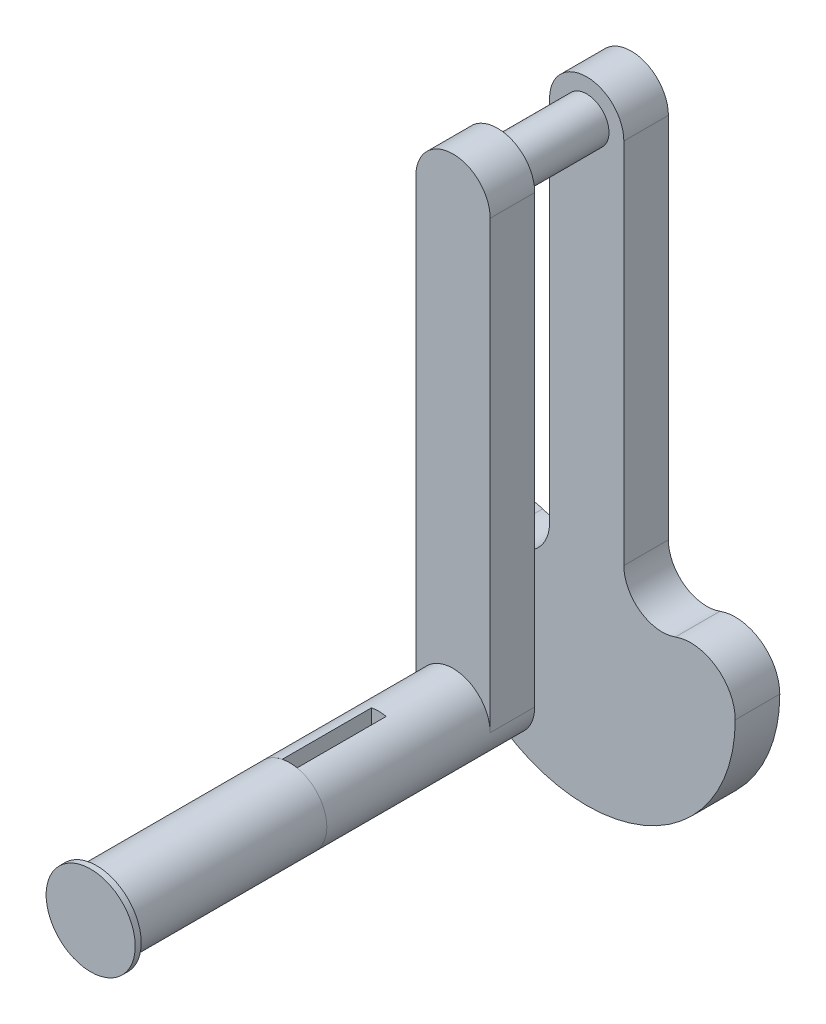
from build123d import *

# Parameters (mm, degrees)
BOSS_EXTRUDE1_START  = 30
BOSS_EXTRUDE1_DEPTH  = 55
BOSS_EXTRUDE3_DEPTH  = 15
SKETCH5_R            = 7.5
BOSS_EXTRUDE4_DEPTH  = 30
BOSS_EXTRUDE5_DEPTH  = 15
BOSS_EXTRUDE7_DEPTH  = 15
BOSS_EXTRUDE8_START  = 65
SKETCH12_R           = 12.5
BOSS_EXTRUDE8_DEPTH  = 65
SKETCH14_R           = 15
BOSS_EXTRUDE9_DEPTH  = 2
SKETCH2_5_W          = 5
SKETCH2_5_H          = 5
BOSS_EXTRUDE10_DEPTH = 30
SKETCH10_R           = 5
BOSS_EXTRUDE11_DEPTH = 15
BOSS_EXTRUDE12_START = 15
SKETCH10_3_R         = 6
SKETCH10_3_R_2       = 5
BOSS_EXTRUDE12_DEPTH = 2


with BuildPart() as part:
    # Sketch2 → Boss-Extrude1 (new body)
    with BuildSketch(Plane.XY.offset(BOSS_EXTRUDE1_START)):
        with BuildLine():
            Line((-2.5, 7.247448714), (-2.5, 12.247448714))
            ThreePointArc((-2.5, 12.247448714), (-7.90569415, -9.682458366), (12.5, 0))
            ThreePointArc((12.5, 0), (9.682458366, 7.90569415), (2.5, 12.247448714))
            Line((2.5, 12.247448714), (2.5, 7.247448714))
            Line((2.5, 7.247448714), (-2.5, 7.247448714))
        make_face()
    extrude(amount=-BOSS_EXTRUDE1_DEPTH)

    # Sketch3 → Boss-Extrude3 (add)
    with BuildSketch(Plane(origin=(0, 0, -25), x_dir=(-1, 0, 0), z_dir=(0, 0, -1))):
        with BuildLine():
            Line((-12.5, 0), (-12.5, 150))
            ThreePointArc((-12.5, 150), (0, 162.5), (12.5, 150))
            Line((12.5, 150), (12.5, 0))
            ThreePointArc((12.5, 0), (0, -12.5), (-12.5, 0))
        make_face()
    extrude(amount=BOSS_EXTRUDE3_DEPTH)

    # Sketch5 → Boss-Extrude4 (add)
    with BuildSketch(Plane(origin=(0, 0, -40), x_dir=(-1, 0, 0), z_dir=(0, 0, -1))):
        with Locations((0, 150)):
            Circle(SKETCH5_R)
    extrude(amount=BOSS_EXTRUDE4_DEPTH)

    # Sketch6 → Boss-Extrude5 (add)
    with BuildSketch(Plane(origin=(0, 0, -70), x_dir=(-1, 0, 0), z_dir=(0, 0, -1))):
        with BuildLine():
            Line((12.5, 150), (12.5, 0))
            ThreePointArc((12.5, 0), (0, -12.5), (-12.5, 0))
            Line((-12.5, 0), (-12.5, 150))
            ThreePointArc((-12.5, 150), (0, 162.5), (12.5, 150))
        make_face()
    extrude(amount=BOSS_EXTRUDE5_DEPTH)

    # Sketch8 → Boss-Extrude7 (add)
    with BuildSketch(Plane(origin=(0, 0, -70), x_dir=(-1, 0, 0), z_dir=(0, 0, -1))):
        with BuildLine():
            ThreePointArc((50, 0), (0, -50), (-50, 0))
            ThreePointArc((-50, 0), (-43.599648561, 12.290079114), (-29.860527384, 14.092048156))
            ThreePointArc((-29.860527384, 14.092048156), (-18.017198913, 15.645372491), (-12.5, 26.239604975))
            ThreePointArc((-12.5, 26.239604975), (0, 38.739604975), (12.5, 26.239604975))
            ThreePointArc((12.5, 26.239604975), (18.017198913, 15.645372491), (29.860527384, 14.092048156))
            ThreePointArc((29.860527384, 14.092048156), (43.599648561, 12.290079114), (50, 0))
        make_face()
    extrude(amount=BOSS_EXTRUDE7_DEPTH)

    # Sketch2<5> → Boss-Extrude10 (add)
    with BuildSketch(Plane.XY):
        with BuildLine():
            Line((-2.5, 7.247448714), (-2.5, 12.247448714))
            ThreePointArc((-2.5, 12.247448714), (-7.90569415, -9.682458366), (12.5, 0))
            ThreePointArc((12.5, 0), (9.682458366, 7.90569415), (2.5, 12.247448714))
            Line((2.5, 12.247448714), (2.5, 7.247448714))
            Line((2.5, 7.247448714), (-2.5, 7.247448714))
        make_face()
        with Locations((0, 9.747448714)):
            Rectangle(SKETCH2_5_W, SKETCH2_5_H)
        with BuildLine():
            ThreePointArc((0, 12.5), (-1.256362025, 12.436701913), (-2.5, 12.247448714))
            Line((-2.5, 12.247448714), (0, 12.247448714))
            Line((0, 12.247448714), (0, 12.5))
        make_face()
        with BuildLine():
            Line((0, 12.5), (0, 12.247448714))
            Line((0, 12.247448714), (2.5, 12.247448714))
            ThreePointArc((2.5, 12.247448714), (1.256362025, 12.436701913), (0, 12.5))
        make_face()
    extrude(amount=-BOSS_EXTRUDE10_DEPTH)

    # Sketch10 → Boss-Extrude11 (add)
    with BuildSketch(Plane(origin=(0, 0, -85), x_dir=(-1, 0, 0), z_dir=(0, 0, -1))):
        with Locations(Location((33.80740392, -9.058666579, 0), (0, 0, 180))):
            Circle(SKETCH10_R)
    extrude(amount=BOSS_EXTRUDE11_DEPTH)

    # Sketch10<3> → Boss-Extrude12 (add)
    # profile 1 of 2: a face of its own
    with BuildSketch(Plane(origin=(0, 0, -85), x_dir=(-1, 0, 0), z_dir=(0, 0, -1)).offset(BOSS_EXTRUDE12_START)):
        with Locations((33.80740392, -9.058666579)):
            Circle(SKETCH10_3_R)
        with Locations(Location((33.80740392, -9.058666579, 0), (0, 0, 180))):
            Circle(SKETCH10_3_R_2, mode=Mode.SUBTRACT)
    # profile 2 of 2: a face of its own
    with BuildSketch(Plane(origin=(0, 0, -85), x_dir=(-1, 0, 0), z_dir=(0, 0, -1)).offset(BOSS_EXTRUDE12_START)):
        with Locations(Location((33.80740392, -9.058666579, 0), (0, 0, 180))):
            Circle(SKETCH10_3_R_2)
    extrude(amount=BOSS_EXTRUDE12_DEPTH)


with BuildPart() as body_2:
    # Sketch12 → Boss-Extrude8 (new body)
    with BuildSketch(Plane.XY.offset(30).offset(BOSS_EXTRUDE8_START)):
        Circle(SKETCH12_R)
    extrude(amount=-BOSS_EXTRUDE8_DEPTH)


with BuildPart() as body_3:
    # Sketch14 → Boss-Extrude9 (new body)
    with BuildSketch(Plane.XY.offset(95)):
        Circle(SKETCH14_R)
    extrude(amount=BOSS_EXTRUDE9_DEPTH)


solid = Compound([part.part, body_2.part, body_3.part])
